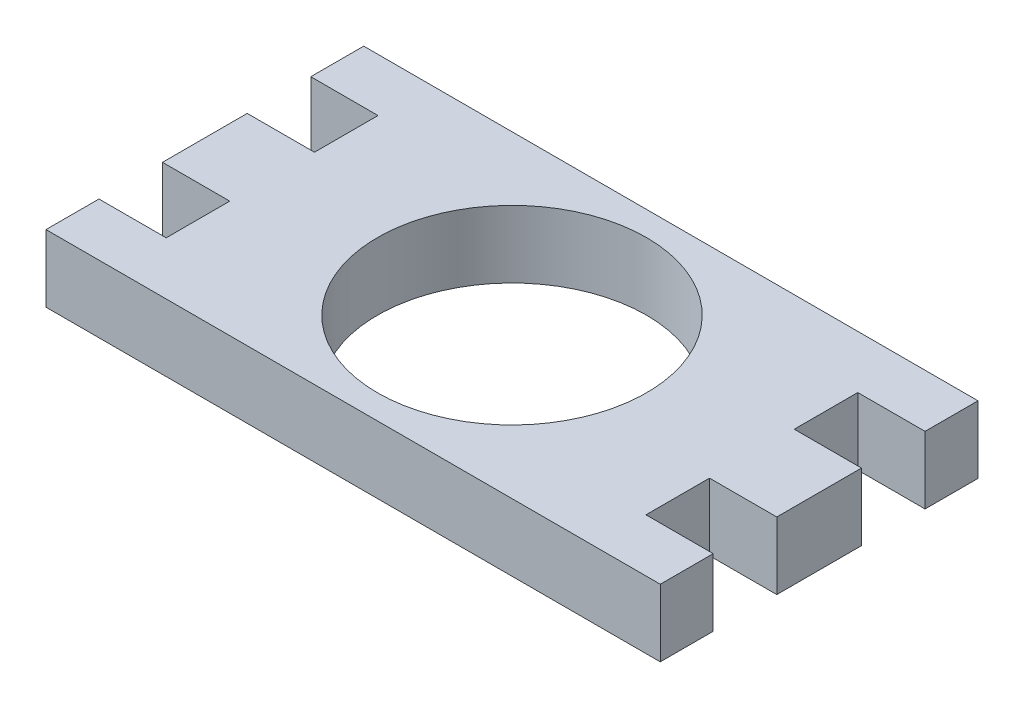
from build123d import *

# Parameters (mm, degrees)
SKETCH1_R           = 12.7
BOSS_EXTRUDE1_DEPTH = 6.35


with BuildPart() as part:
    # Sketch1 → Boss-Extrude1 (new body)
    with BuildSketch(Plane(origin=(0, 0, 0), x_dir=(1, 0, 0), z_dir=(0, 1, 0))):
        Polygon((-29, 15), (29, 15), (29, 10), (22.65, 10), (22.65, 4), (29, 4), (29, -4), (22.65, -4), (22.65, -10), (29, -10), (29, -15), (-29, -15), (-29, -10), (-22.65, -10), (-22.65, -4), (-29, -4), (-29, 4), (-22.65, 4), (-22.65, 10), (-29, 10), align=None)
        with Locations(Location((0, 0, 0), (0, 0, 270))):
            Circle(SKETCH1_R, mode=Mode.SUBTRACT)
    extrude(amount=BOSS_EXTRUDE1_DEPTH)


solid = part.part
